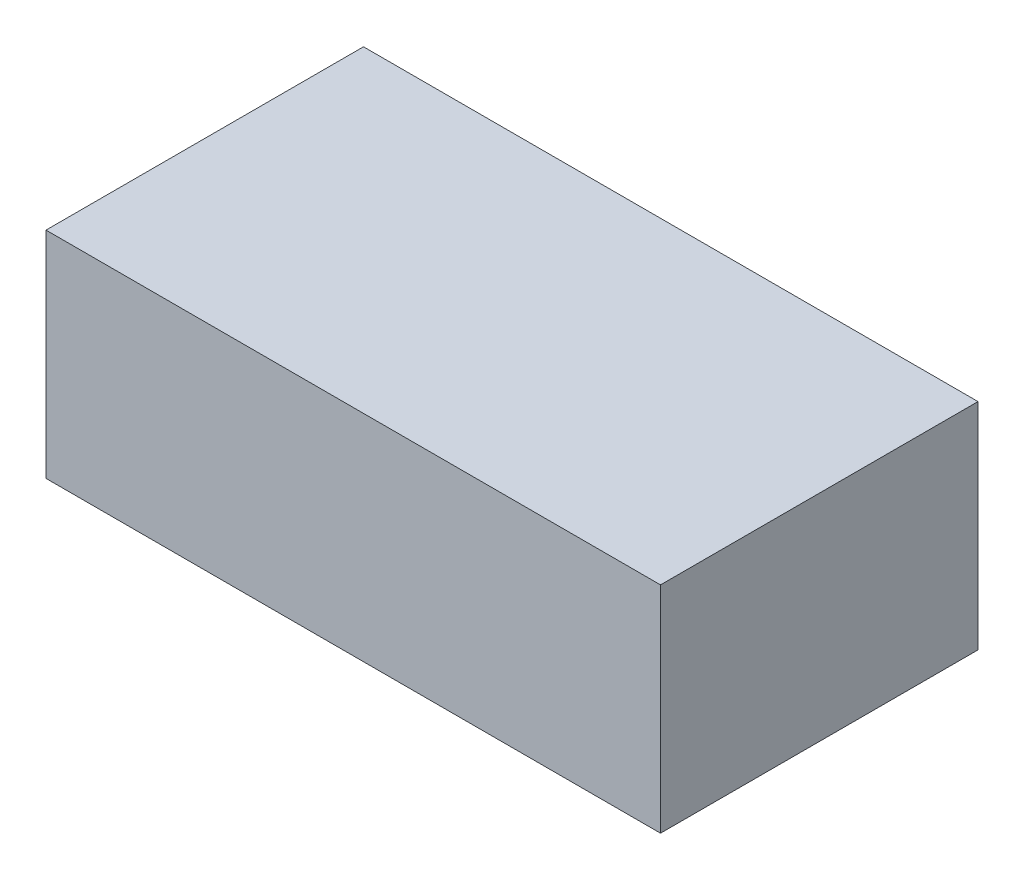
from build123d import *

# Parameters (mm, degrees)
SKETCH1_W           = 59.999999888
SKETCH1_H           = 31.000100052
BOSS_EXTRUDE1_DEPTH = 20.99999991


with BuildPart() as part:
    # Sketch1 → Boss-Extrude1 (new body)
    with BuildSketch(Plane(origin=(0, 0, 0), x_dir=(1, 0, 0), z_dir=(0, 1, 0))):
        with Locations((29.999999944, 15.500050026)):
            Rectangle(SKETCH1_W, SKETCH1_H)
    extrude(amount=BOSS_EXTRUDE1_DEPTH)


solid = part.part
